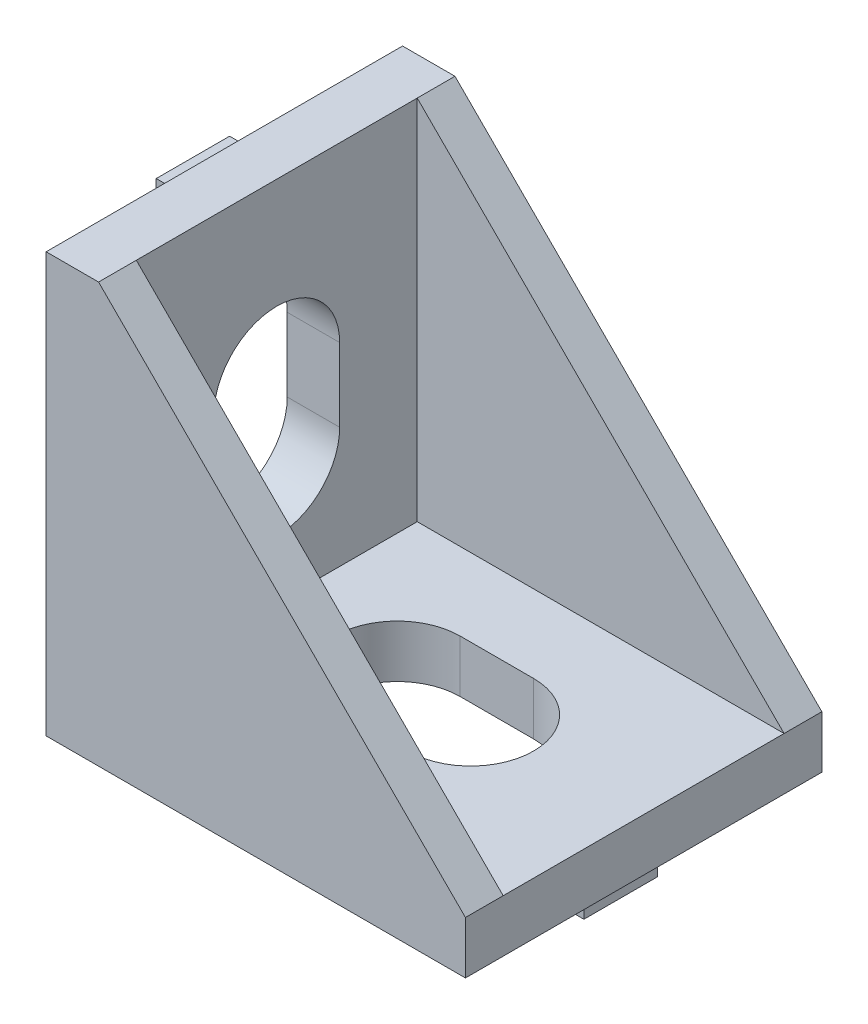
from build123d import *

# Parameters (mm, degrees)
BOSS_EXTRUDE1_DEPTH = 8.5
CUT_EXTRUDE2_START  = -2.5
SKETCH2_W           = 17.5
SKETCH2_H           = 13.4
CUT_EXTRUDE2_DEPTH  = 28.033878851
CUT_EXTRUDE3_DEPTH  = 17
CUT_EXTRUDE4_DEPTH  = 17
SKETCH5_W           = 1.8
SKETCH5_H           = 3.5
BOSS_EXTRUDE2_DEPTH = 1.5
SKETCH6_W           = 3.5
SKETCH6_H           = 1.8
BOSS_EXTRUDE3_DEPTH = 1.5


with BuildPart() as part:
    # Sketch1 → Boss-Extrude1 (new, symmetric)
    with BuildSketch(Plane.XY):
        Polygon((0, 20), (2.5, 20), (20, 2.5), (20, 0), (0, 0), align=None)
    extrude(amount=BOSS_EXTRUDE1_DEPTH, both=True)

    # Sketch2 → Cut-Extrude2 (cut, through all)
    with BuildSketch(Plane.XZ.offset(CUT_EXTRUDE2_START)):
        with Locations((11.25, 0)):
            Rectangle(SKETCH2_W, SKETCH2_H)
    extrude(amount=-CUT_EXTRUDE2_DEPTH, mode=Mode.SUBTRACT)

    # Sketch3 → Cut-Extrude3 (cut)
    with BuildSketch(Plane(origin=(0, 2.5, 0), x_dir=(1, 0, 0), z_dir=(0, 1, 0))):
        with BuildLine():
            Line((8.25, 3), (11.75, 3))
            ThreePointArc((11.75, 3), (14.75, 0), (11.75, -3))
            Line((11.75, -3), (8.25, -3))
            ThreePointArc((8.25, -3), (5.25, 0), (8.25, 3))
        make_face()
    extrude(amount=-CUT_EXTRUDE3_DEPTH, mode=Mode.SUBTRACT)

    # Sketch4 → Cut-Extrude4 (cut)
    with BuildSketch(Plane(origin=(2.5, 0, 0), x_dir=(0, 0, -1), z_dir=(1, 0, 0))):
        with BuildLine():
            Line((-3, 8.25), (-3, 11.75))
            ThreePointArc((-3, 11.75), (0, 14.75), (3, 11.75))
            Line((3, 11.75), (3, 8.25))
            ThreePointArc((3, 8.25), (0, 5.25), (-3, 8.25))
        make_face()
    extrude(amount=-CUT_EXTRUDE4_DEPTH, mode=Mode.SUBTRACT)

    # Sketch5 → Boss-Extrude2 (add)
    with BuildSketch(Plane.XZ):
        with Locations((2, 0)):
            Rectangle(SKETCH5_W, SKETCH5_H)
        with Locations((18, 0)):
            Rectangle(SKETCH5_W, SKETCH5_H)
    extrude(amount=BOSS_EXTRUDE2_DEPTH)

    # Sketch6 → Boss-Extrude3 (add)
    with BuildSketch(Plane.ZY):
        with Locations((0, 2)):
            Rectangle(SKETCH6_W, SKETCH6_H)
        with Locations((0, 18)):
            Rectangle(SKETCH6_W, SKETCH6_H)
    extrude(amount=BOSS_EXTRUDE3_DEPTH)


solid = part.part
